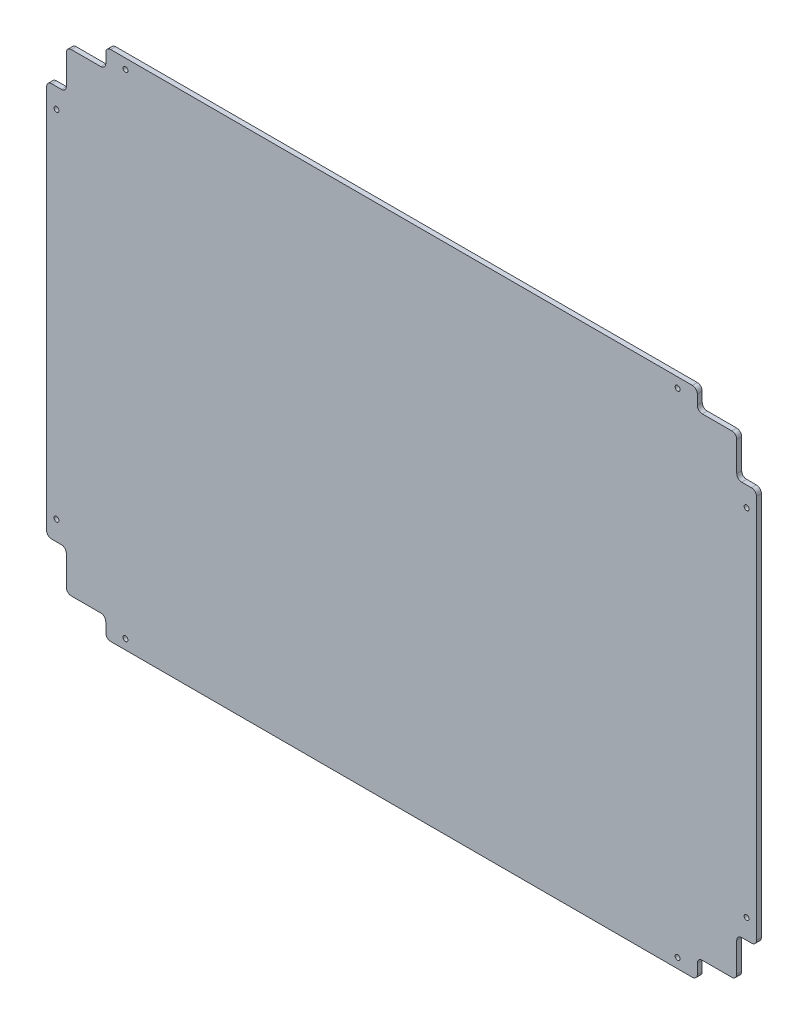
from build123d import *

# Parameters (mm, degrees)
SKETCH_1_W          = 720
SKETCH_1_H          = 520
EXTRUDE_1_DEPTH     = 5
CUT_EXTRUDE_1_DEPTH = 445.100213916
SKETCH_3_R          = 2.5
CUT_EXTRUDE_2_DEPTH = 445.100213916
FILLET_1_R          = 5


with BuildPart() as part:
    # 草图1 → 凸台-拉伸1 (new body)
    with BuildSketch(Plane.XY):
        Rectangle(SKETCH_1_W, SKETCH_1_H)
    extrude(amount=EXTRUDE_1_DEPTH)

    # 草图2 → 切除-拉伸1 (cut, through all)
    with BuildSketch(Plane.XY.offset(5)):
        Polygon((340, -240), (340, -200), (360, -200), (360, -260), (300, -260), (300, -240), align=None)
        Polygon((340, 240), (300, 240), (300, 260), (360, 260), (360, 200), (340, 200), align=None)
        Polygon((-340, 240), (-340, 200), (-360, 200), (-360, 260), (-300, 260), (-300, 240), align=None)
        Polygon((-340, -240), (-300, -240), (-300, -260), (-360, -260), (-360, -200), (-340, -200), align=None)
    extrude(amount=-CUT_EXTRUDE_1_DEPTH, mode=Mode.SUBTRACT)

    # 草图3 → 切除-拉伸2 (cut, through all)
    with BuildSketch(Plane.XY.offset(5)):
        with Locations((350, 180)):
            Circle(SKETCH_3_R)
        with Locations((280, 250)):
            Circle(SKETCH_3_R)
        with Locations((-280, 250)):
            Circle(SKETCH_3_R)
        with Locations((-350, 180)):
            Circle(SKETCH_3_R)
        with Locations((-350, -180)):
            Circle(SKETCH_3_R)
        with Locations((-280, -250)):
            Circle(SKETCH_3_R)
        with Locations((350, -180)):
            Circle(SKETCH_3_R)
        with Locations((280, -250)):
            Circle(SKETCH_3_R)
    extrude(amount=-CUT_EXTRUDE_2_DEPTH, mode=Mode.SUBTRACT)

    # 圆角1
    fillet_1_edges = [part.edges().sort_by_distance(p)[0] for p in [
        (-360, -200, 2.5),
        (-340, -200, 2.5),
        (-340, -240, 2.5),
        (-300, -240, 2.5),
        (-300, -260, 2.5),
        (-300, 260, 2.5),
        (-300, 240, 2.5),
        (-340, 240, 2.5),
        (-340, 200, 2.5),
        (-360, 200, 2.5),
        (360, 200, 2.5),
        (340, 200, 2.5),
        (340, 240, 2.5),
        (300, 240, 2.5),
        (300, 260, 2.5),
        (300, -260, 2.5),
        (300, -240, 2.5),
        (340, -240, 2.5),
        (340, -200, 2.5),
        (360, -200, 2.5),
    ]]
    fillet(fillet_1_edges, radius=FILLET_1_R)


solid = part.part
